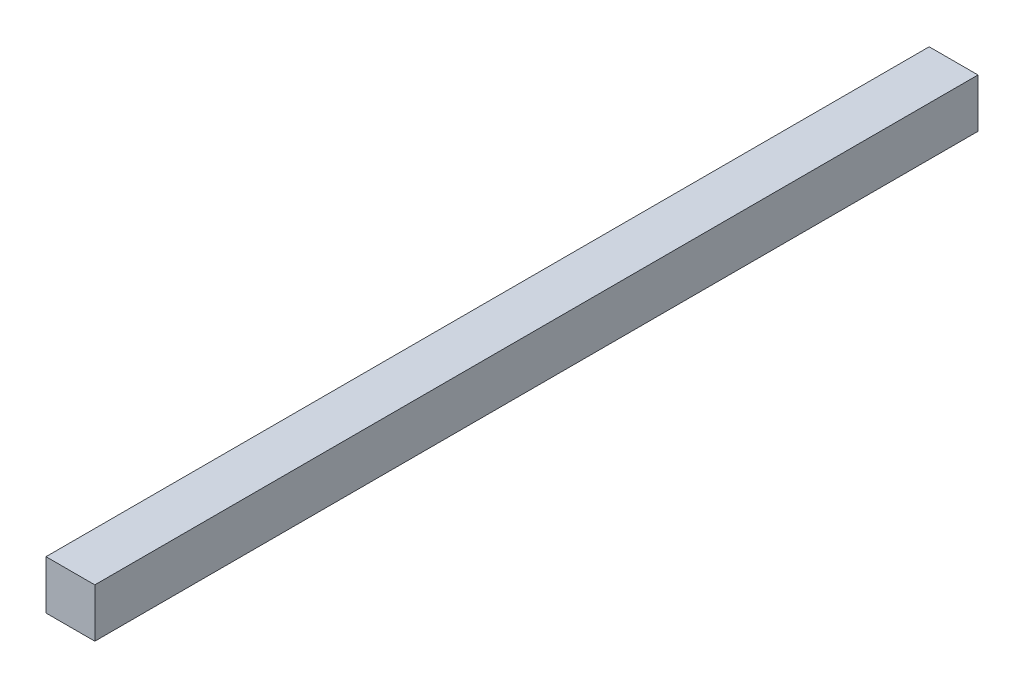
from build123d import *

# Parameters (mm, degrees)
SKETCH1_W           = 9.95
SKETCH1_H           = 9.95
BOSS_EXTRUDE1_DEPTH = 180


with BuildPart() as part:
    # Sketch1 → Boss-Extrude1 (new body)
    with BuildSketch(Plane.XY):
        Rectangle(SKETCH1_W, SKETCH1_H)
    extrude(amount=BOSS_EXTRUDE1_DEPTH)


solid = part.part
